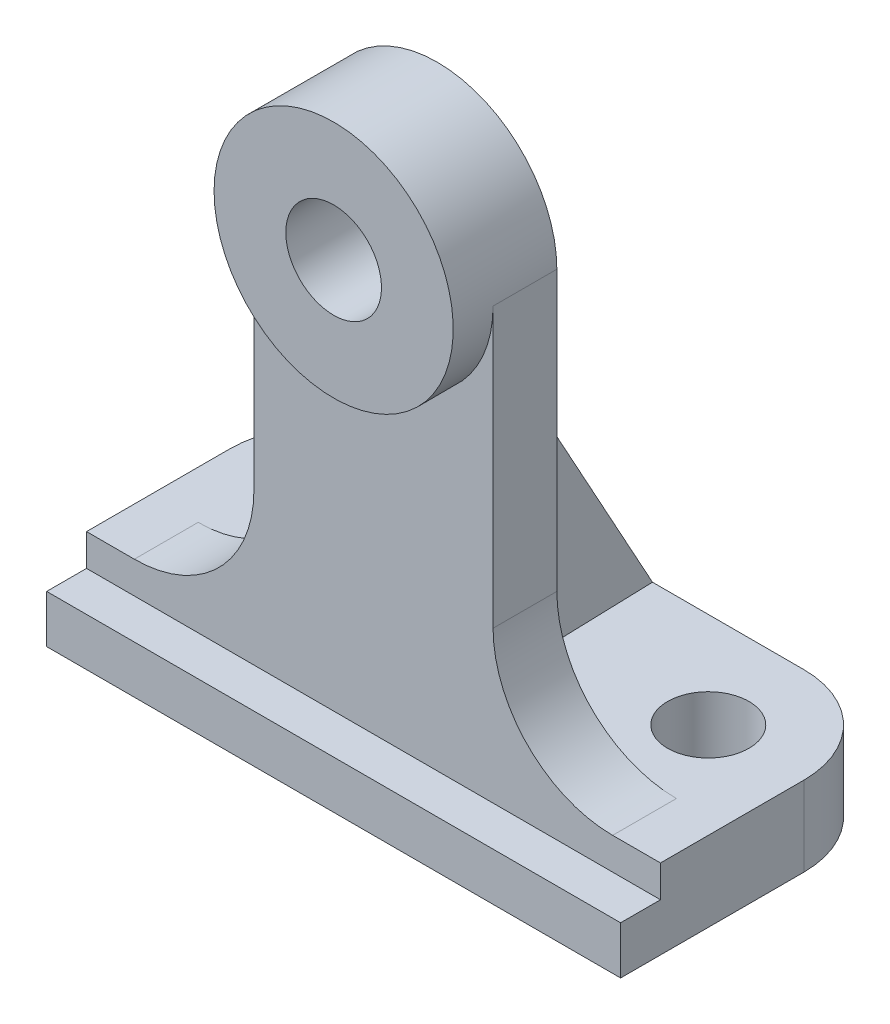
from build123d import *
from build123d.topology import SkipClean

# Parameters (mm, degrees)
SKETCH1_W           = 72
SKETCH1_H           = 10
BOSS_EXTRUDE1_DEPTH = 35
SKETCH2_W           = 72
SKETCH2_H           = 4
CUT_EXTRUDE1_DEPTH  = 5
SKETCH3_W           = 30
SKETCH3_H           = 8
BOSS_EXTRUDE3_DEPTH = 50
SKETCH5_R           = 15
SKETCH5_R_2         = 6
EXTRUDE_THIN1_DEPTH = 13
CUT_EXTRUDE2_START  = -13
CUT_EXTRUDE2_DEPTH  = 13
FILLET2_R           = 15
RIB12_REACH         = 88.145
SKETCH7_WALL_W      = 219.941301276
SKETCH7_WALL_H      = 10
RIB12_DRAFT_ANGLE   = 2
FILLET3_R           = 12
SKETCH9_R           = 5.1
CUT_EXTRUDE5_DEPTH  = 5


with BuildPart() as part:
    # Sketch1 → Boss-Extrude1 (new body)
    with BuildSketch(Plane.XY):
        Rectangle(SKETCH1_W, SKETCH1_H)
    extrude(amount=BOSS_EXTRUDE1_DEPTH)

    # Sketch2 → Cut-Extrude1 (cut)
    with BuildSketch(Plane.XY.offset(35)):
        with Locations((0, 3)):
            Rectangle(SKETCH2_W, SKETCH2_H)
    extrude(amount=-CUT_EXTRUDE1_DEPTH, mode=Mode.SUBTRACT)

    # Sketch3 → Boss-Extrude3 (add)
    with BuildSketch(Plane(origin=(0, 5, 0), x_dir=(1, 0, 0), z_dir=(0, 1, 0))):
        with Locations((0, -26)):
            Rectangle(SKETCH3_W, SKETCH3_H)
    extrude(amount=BOSS_EXTRUDE3_DEPTH)

    # Sketch5 → Extrude-Thin1 (add)
    with BuildSketch(Plane(origin=(0, 0, 22), x_dir=(-1, 0, 0), z_dir=(0, 0, -1))):
        with Locations((0, 55)):
            Circle(SKETCH5_R)
        with Locations((0, 55)):
            Circle(SKETCH5_R_2, mode=Mode.SUBTRACT)
    extrude(amount=-EXTRUDE_THIN1_DEPTH)

    # Sketch6 → Cut-Extrude2 (cut)
    with SkipClean():  # the faces are left unmerged after this step: merging them gives an invalid solid
        with BuildSketch(Plane.XY.offset(30).offset(CUT_EXTRUDE2_START)):
            with BuildLine():
                Line((6, 55), (-6, 55))
                ThreePointArc((-6, 55), (0, 49), (6, 55))
            make_face()
        extrude(amount=CUT_EXTRUDE2_DEPTH, mode=Mode.SUBTRACT)

    # Fillet2
    fillet2_edges = [part.edges().sort_by_distance(p)[0] for p in [
        (-15, 5, 26),
        (15, 5, 26),
    ]]
    fillet(fillet2_edges, radius=FILLET2_R)

    # Sketch7 wall → Rib12 (add, up to next)
    with BuildSketch(Plane(origin=(0, 25, 11), x_dir=(0, 0.876215908677, 0.481918749772), z_dir=(0, -0.481918749772, 0.876215908677)), mode=Mode.PRIVATE) as rib12_sk1:
        Rectangle(SKETCH7_WALL_W, SKETCH7_WALL_H)
    rib12_tool1 = extrude(rib12_sk1.sketch, amount=RIB12_REACH, mode=Mode.PRIVATE) - part.part
    add(rib12_tool1.solids().sort_by_distance((0, 25, 11))[0])

    # Rib12 draft
    rib12_draft_faces = [part.faces().sort_by_distance(p)[0] for p in [
        (-5, 24.759040625, 11.438107954),
        (5, 24.759040625, 11.438107954),
    ]]
    draft(rib12_draft_faces, Plane(origin=(0, 25, 11), x_dir=(0, 0.876215908677, 0.481918749772), z_dir=(0, 0.481918749772, -0.876215908677)), RIB12_DRAFT_ANGLE)

    # Fillet3
    fillet3_edges = [part.edges().sort_by_distance(p)[0] for p in [
        (-36, 0, 0),
        (36, 0, 0),
    ]]
    fillet(fillet3_edges, radius=FILLET3_R)

    # Sketch9 → Cut-Extrude5 (cut, symmetric)
    with SkipClean():  # the faces are left unmerged after this step: merging them gives an invalid solid
        with BuildSketch(Plane(origin=(0, 0, 0), x_dir=(1, 0, 0), z_dir=(0, 1, 0))):
            with Locations(Location((-24, -12, 0), (0, 0, 270))):
                Circle(SKETCH9_R)
            with Locations(Location((24, -12, 0), (0, 0, 270))):
                Circle(SKETCH9_R)
        extrude(amount=CUT_EXTRUDE5_DEPTH, both=True, mode=Mode.SUBTRACT)


solid = part.part
